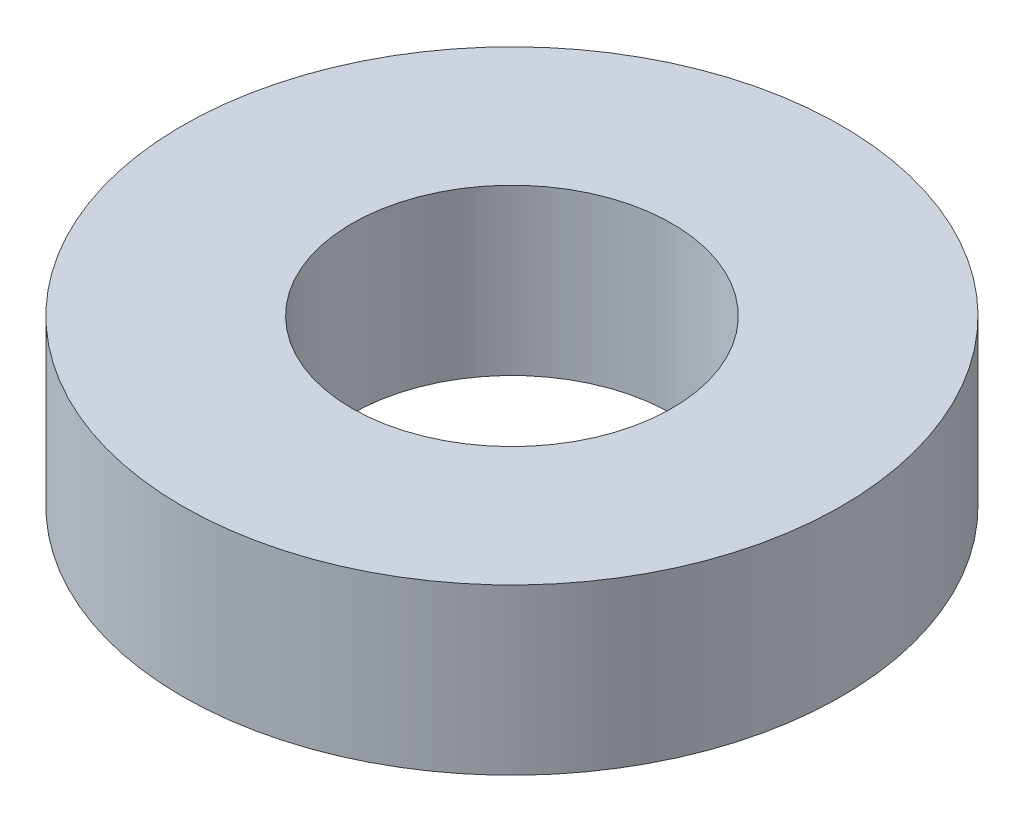
from build123d import *

# Parameters (mm, degrees)
SKETCH1_R           = 3.5
SKETCH1_R_2         = 1.7
BOSS_EXTRUDE1_DEPTH = 1.75


with BuildPart() as part:
    # Sketch1 → Boss-Extrude1 (new body)
    with BuildSketch(Plane(origin=(0, 0, 0), x_dir=(1, 0, 0), z_dir=(0, 1, 0))):
        with Locations(Location((0, 0, 0), (0, 0, 270))):
            Circle(SKETCH1_R)
        with Locations(Location((0, 0, 0), (0, 0, 270))):
            Circle(SKETCH1_R_2, mode=Mode.SUBTRACT)
    extrude(amount=BOSS_EXTRUDE1_DEPTH)


solid = part.part
